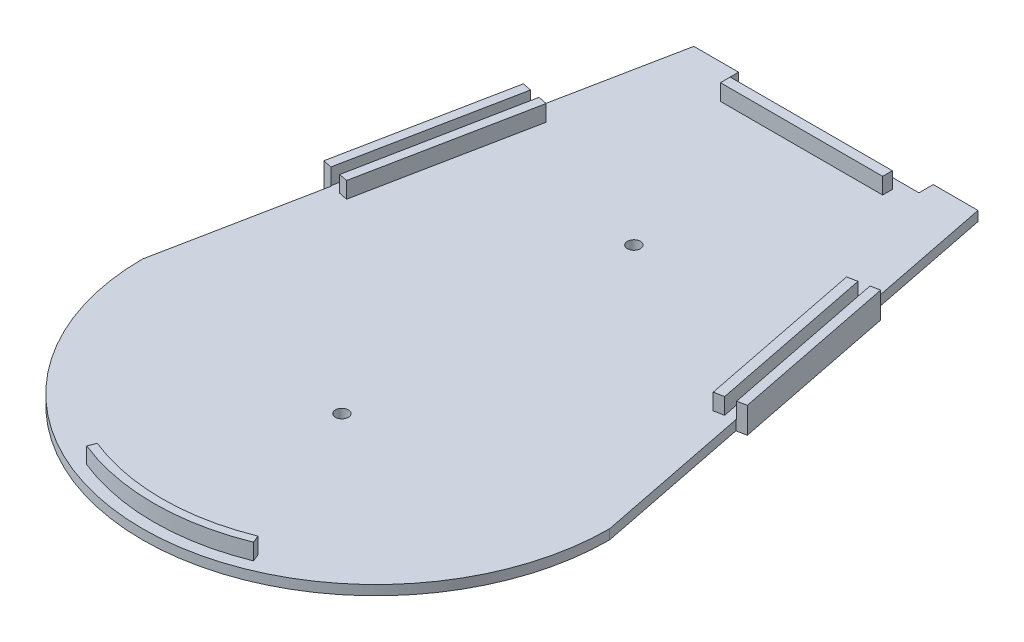
from build123d import *

# Parameters (mm, degrees)
SALIENTE_EXTRUIR1_DEPTH      = 3
SALIENTE_EXTRUIR3_DEPTH      = 5
CROQUIS5_W                   = 50
CROQUIS5_H                   = 3
SALIENTE_EXTRUIR4_DEPTH      = 5
SALIENTE_EXTRUIR6_DEPTH      = 5
SALIENTE_EXTRUIR7_DEPTH      = 5
SALIENTE_EXTRUIR7_DEPTH_BACK = 3
CORTAR_EXTRUIR2_DEPTH        = 5
CROQUIS11_R                  = 2
CORTAR_EXTRUIR3_DEPTH        = 5


with BuildPart() as part:
    # Croquis2 → Saliente-Extruir1 (new body)
    with BuildSketch(Plane(origin=(0, 0, 0), x_dir=(1, 0, 0), z_dir=(0, 1, 0))):
        with BuildLine():
            Line((-66.516806956, -7.313551242), (-72, -34.872839919))
            ThreePointArc((-72, -34.872839919), (0, -106.872839919), (72, -34.872839919))
            Line((72, -34.872839919), (66.516806956, -7.313551242))
            ThreePointArc((66.516806956, -7.313551242), (0, 37.127160081), (-66.516806956, -7.313551242))
        make_face()
        with BuildLine():
            Line((-43.798295131, 106.872839919), (-66.516806956, -7.313551242))
            ThreePointArc((-66.516806956, -7.313551242), (0, 37.127160081), (66.516806956, -7.313551242))
            Line((66.516806956, -7.313551242), (43.798295131, 106.872839919))
            Line((43.798295131, 106.872839919), (30, 106.872839919))
            Line((30, 106.872839919), (30, 102.472839919))
            Line((30, 102.472839919), (-30, 102.472839919))
            Line((-30, 102.472839919), (-30, 106.872839919))
            Line((-30, 106.872839919), (-43.798295131, 106.872839919))
        make_face()
    extrude(amount=SALIENTE_EXTRUIR1_DEPTH)

    # Croquis3 → Saliente-Extruir3 (add)
    with BuildSketch(Plane(origin=(0, 3, 0), x_dir=(1, 0, 0), z_dir=(0, 1, 0))):
        with BuildLine():
            Line((0, -100.872839919), (0, -103.372839919))
            ThreePointArc((0, -103.372839919), (13.091100059, -102.110278145), (25.699621359, -98.369134787))
            Line((25.699621359, -98.369134787), (24.761678974, -96.051751763))
            ThreePointArc((24.761678974, -96.051751763), (12.613322685, -99.656357042), (0, -100.872839919))
        make_face()
        with BuildLine():
            ThreePointArc((-25.699621359, -98.369134787), (-13.091100059, -102.110278145), (0, -103.372839919))
            Line((0, -103.372839919), (0, -100.872839919))
            ThreePointArc((0, -100.872839919), (-12.613322685, -99.656357042), (-24.761678974, -96.051751763))
            Line((-24.761678974, -96.051751763), (-25.699621359, -98.369134787))
        make_face()
    extrude(amount=SALIENTE_EXTRUIR3_DEPTH)

    # Croquis5 → Saliente-Extruir4 (add)
    with BuildSketch(Plane(origin=(0, 3, 0), x_dir=(1, 0, 0), z_dir=(0, 1, 0))):
        with Locations((0, 97.772839919)):
            Rectangle(CROQUIS5_W, CROQUIS5_H)
    extrude(amount=SALIENTE_EXTRUIR4_DEPTH)

    # Croquis6 → Saliente-Extruir6 (add)
    with BuildSketch(Plane(origin=(0, 3, 0), x_dir=(1, 0, 0), z_dir=(0, 1, 0))):
        Polygon((-46.298308612, 63.855049889), (-49.044482423, 64.401428328), (-59.164112379, 13.069022297), (-56.507839729, 12.540530583), align=None)
        Polygon((56.507539535, 12.540530583), (46.298008419, 63.855049889), (49.240337502, 64.440455359), (59.449868619, 13.125936053), align=None)
    extrude(amount=SALIENTE_EXTRUIR6_DEPTH)

    # Croquis8 → Saliente-Extruir7 (add, two sides: drawn at the far end of the back side and taken through both)
    with BuildSketch(Plane(origin=(0, 3, 0), x_dir=(1, 0, 0), z_dir=(0, 1, 0)).offset(-SALIENTE_EXTRUIR7_DEPTH_BACK)):
        Polygon((-65.278264707, 14.285493372), (-62.335935624, 13.700087901), (-52.126404507, 65.014607207), (-55.06873359, 65.600012678), align=None)
        Polygon((52.126393076, 65.014664659), (62.335924193, 13.700145353), (65.277964514, 14.285493372), (55.068433397, 65.600012678), align=None)
    extrude(amount=SALIENTE_EXTRUIR7_DEPTH + SALIENTE_EXTRUIR7_DEPTH_BACK)

    # Croquis9 → Cortar-Extruir2 (cut)
    with BuildSketch(Plane(origin=(0, 8, 0), x_dir=(1, 0, 0), z_dir=(0, 1, 0))):
        Polygon((62.335924193, 13.700145353), (62.532079465, 13.739172384), (52.322548348, 65.05369169), (52.126393076, 65.014664659), align=None)
        Polygon((-62.532090896, 13.739114932), (-62.335935624, 13.700087901), (-52.126404507, 65.014607207), (-52.322559779, 65.053634238), align=None)
    extrude(amount=-CORTAR_EXTRUIR2_DEPTH, mode=Mode.SUBTRACT)

    # Croquis11 → Cortar-Extruir3 (cut)
    with BuildSketch(Plane(origin=(0, 3, 0), x_dir=(1, 0, 0), z_dir=(0, 1, 0))):
        with Locations(Location((-0.000150097, 44.590728717, 0), (0, 0, 270))):
            Circle(CROQUIS11_R)
        with Locations(Location((-0.000150097, -45.409271283, 0), (0, 0, 270))):
            Circle(CROQUIS11_R)
    extrude(amount=-CORTAR_EXTRUIR3_DEPTH, mode=Mode.SUBTRACT)


solid = part.part
